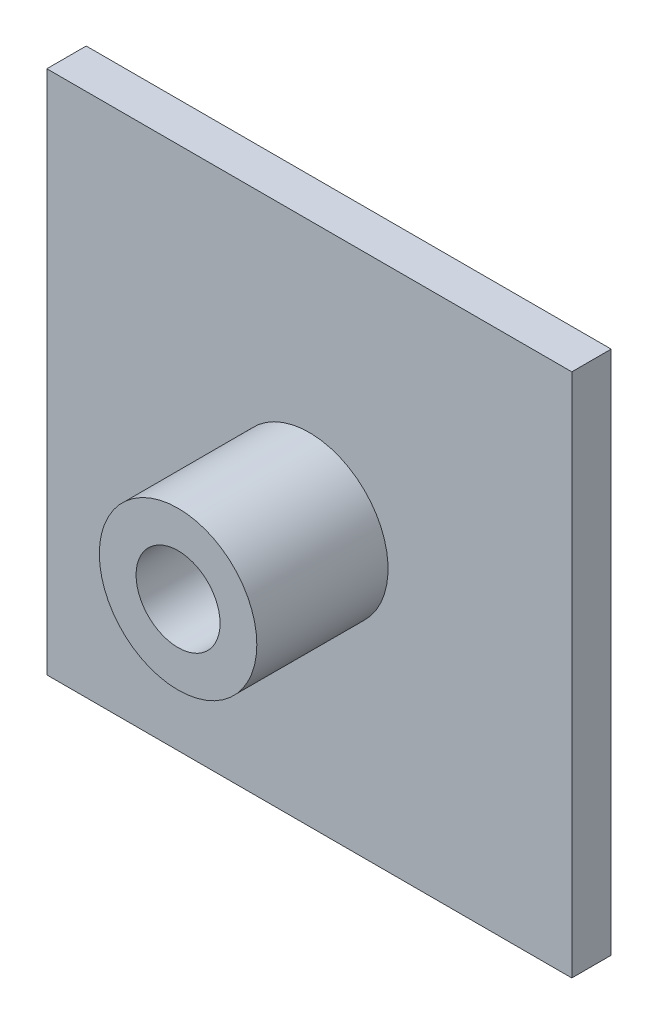
from build123d import *

# Parameters (mm, degrees)
SKETCH_2_W        = 20
SKETCH_2_H        = 20
SKETCH_2_R        = 1.6
EXTRUDE_433_DEPTH = 1.5
SKETCH_3_R        = 3
SKETCH_3_R_2      = 1.6
EXTRUDE_659_DEPTH = 5
CHAMFER_1_SIZE    = 1.5


with BuildPart() as part:
    # Эскиз2 → Extrude 433 (new body)
    with BuildSketch(Plane.XY):
        Rectangle(SKETCH_2_W, SKETCH_2_H)
        Circle(SKETCH_2_R, mode=Mode.SUBTRACT)
    extrude(amount=EXTRUDE_433_DEPTH)

    # Эскиз3 → Extrude 659 (add)
    with BuildSketch(Plane.XY.offset(1.5)):
        with Locations(Location((0, 0, 0), (0, 0, 180))):
            Circle(SKETCH_3_R)
        Circle(SKETCH_3_R_2, mode=Mode.SUBTRACT)
    extrude(amount=EXTRUDE_659_DEPTH)

    # Фаска1
    chamfer_1_edges = [part.edges().sort_by_distance(p)[0] for p in [
        (-1.6, 0, 0),
    ]]
    chamfer(chamfer_1_edges, length=CHAMFER_1_SIZE)


solid = part.part
